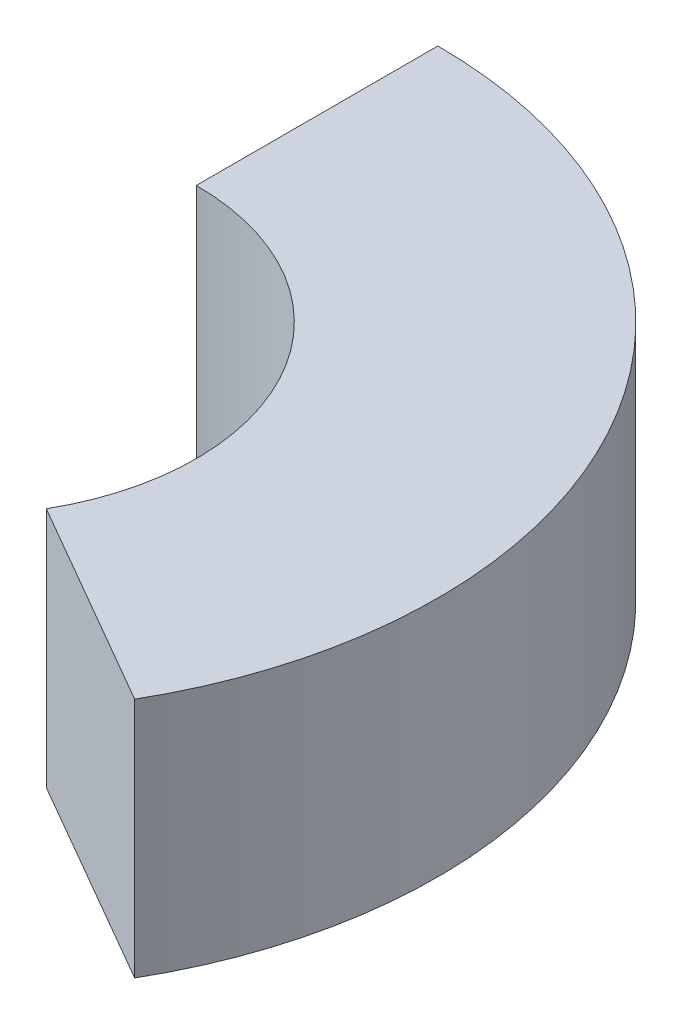
from build123d import *

# Parameters (mm, degrees)
BOSS_EXTRUDE1_DEPTH = 150


with BuildPart() as part:
    # Sketch1 → Boss-Extrude1 (new body)
    with BuildSketch(Plane(origin=(0, 0, 0), x_dir=(1, 0, 0), z_dir=(0, 1, 0))):
        with BuildLine():
            ThreePointArc((0, 297), (257.209544924, 148.5), (257.209544924, -148.5))
            Line((257.209544924, -148.5), (127.305734356, -73.5))
            ThreePointArc((127.305734356, -73.5), (127.305734356, 73.5), (0, 147))
            Line((0, 147), (0, 297))
        make_face()
    extrude(amount=BOSS_EXTRUDE1_DEPTH)


solid = part.part
